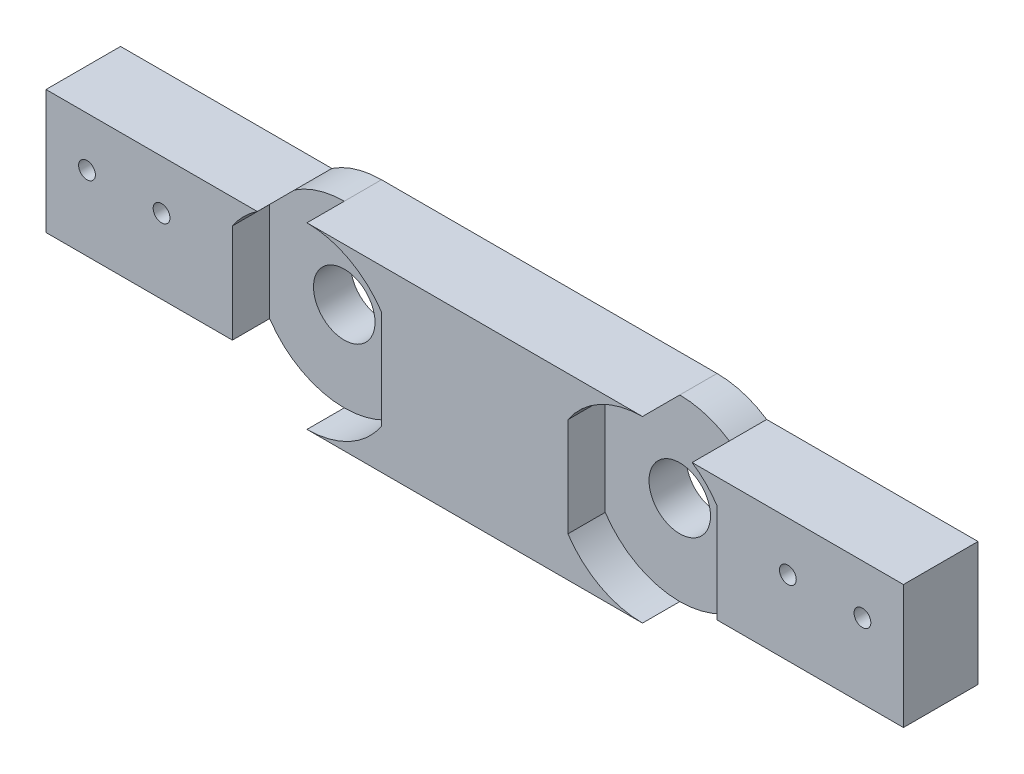
from build123d import *

# Parameters (mm, degrees)
SKETCH_1_W                  = 130
SKETCH_1_H                  = 48
SKETCH_1_R                  = 8.25
EXTRUDE_1_DEPTH             = 10
CUT_EXTRUDE_1_DEPTH         = 10
EXTRUDE_START               = 10
EXTRUDE_2_DEPTH             = 10
SKETCH_6_W                  = 10
SKETCH_6_H                  = 26.532998322
EXTRUDE_3_DEPTH             = 50
SKETCH_7_W                  = 50
SKETCH_7_H                  = 26.532998322
EXTRUDE_4_DEPTH             = 10
HOLE_WIZARD_M4_1_AT_2_COUNT = 2
HOLE_WIZARD_M4_1_AT_2_PITCH = 20
EXTRUDE_6_DEPTH             = 20


with BuildPart() as part:
    # 스케치1 → 보스-돌출1 (new body)
    with BuildSketch(Plane.XY):
        with Locations((45, 0)):
            Rectangle(SKETCH_1_W, SKETCH_1_H)
        Circle(SKETCH_1_R, mode=Mode.SUBTRACT)
        with Locations((90, 0)):
            Circle(SKETCH_1_R, mode=Mode.SUBTRACT)
    extrude(amount=EXTRUDE_1_DEPTH)

    # 스케치4 → 컷-돌출1 (cut)
    with BuildSketch(Plane.XY.offset(10)):
        with BuildLine():
            Line((-20, 24), (-20, 13.266499161))
            ThreePointArc((-20, 13.266499161), (-11.349097324, 21.147056295), (0, 24))
            Line((0, 24), (-20, 24))
        make_face()
        with BuildLine():
            ThreePointArc((0, -24), (-11.349097324, -21.147056295), (-20, -13.266499161))
            Line((-20, -13.266499161), (-20, -24))
            Line((-20, -24), (0, -24))
        make_face()
        with BuildLine():
            ThreePointArc((110, -13.266499161), (101.349097324, -21.147056295), (90, -24))
            Line((90, -24), (110, -24))
            Line((110, -24), (110, -13.266499161))
        make_face()
        with BuildLine():
            Line((110, 24), (90, 24))
            ThreePointArc((90, 24), (101.349097324, 21.147056295), (110, 13.266499161))
            Line((110, 13.266499161), (110, 24))
        make_face()
    extrude(amount=-CUT_EXTRUDE_1_DEPTH, mode=Mode.SUBTRACT)

    # 스케치5 → 보스-돌출2 (add)
    with BuildSketch(Plane.XY.offset(10).offset(EXTRUDE_START)):
        with BuildLine():
            Line((20, -13.266499161), (20, 13.266499161))
            ThreePointArc((20, 13.266499161), (11.349097324, 21.147056295), (0, 24))
            Line((0, 24), (90, 24))
            ThreePointArc((90, 24), (78.650902676, 21.147056295), (70, 13.266499161))
            Line((70, 13.266499161), (70, -13.266499161))
            ThreePointArc((70, -13.266499161), (78.650902676, -21.147056295), (90, -24))
            Line((90, -24), (0, -24))
            ThreePointArc((0, -24), (11.349097324, -21.147056295), (20, -13.266499161))
        make_face()
    extrude(amount=-EXTRUDE_2_DEPTH)

    # 스케치6 → 보스-돌출3 (add)
    with BuildSketch(Plane(origin=(110, 0, 0), x_dir=(0, 0, -1), z_dir=(1, 0, 0))):
        with Locations((-5, 0)):
            Rectangle(SKETCH_6_W, SKETCH_6_H)
    extrude_3 = extrude(amount=EXTRUDE_3_DEPTH)

    # 스케치7 → 보스-돌출4 (add)
    with BuildSketch(Plane.XY.offset(10)):
        with Locations((135, 0)):
            Rectangle(SKETCH_7_W, SKETCH_7_H)
    extrude_4 = extrude(amount=EXTRUDE_4_DEPTH)

    # 대칭 복사2: 보스-돌출3, 보스-돌출4 across plane
    add(extrude_3.mirror(Plane.ZY.offset(-45)))
    add(extrude_4.mirror(Plane.ZY.offset(-45)))

    # 스케치11 → M4 남비 머리 나사용 카운터보어1 (revolve, cut)
    with BuildSketch(Plane(origin=(-59, 6.733500839, 30), x_dir=(0, -1, 0), z_dir=(1, 0, 0))):
        Polygon((0, 0), (0, 31.351936393), (2.25, 30), (2.25, 3.1), (4.5, 3.1), (4.5, 0), align=None)
    hole_wizard_m4_1 = revolve(axis=Axis((-59, 6.733500839, 36.35), (0, 0, -1)), mode=Mode.SUBTRACT)

    # M4 남비 머리 나사용 카운터보어1 at 2: M4 남비 머리 나사용 카운터보어1 ×2
    with Locations(*[(i * HOLE_WIZARD_M4_1_AT_2_PITCH, 0, 0) for i in range(1, HOLE_WIZARD_M4_1_AT_2_COUNT)]):
        add(hole_wizard_m4_1, mode=Mode.SUBTRACT)

    # 스케치14 → 보스-돌출6 (add, through all)
    with BuildSketch(Plane.XY.offset(20)):
        with BuildLine():
            ThreePointArc((-20, 13.266499161), (-16.991935867, 16.949162679), (-13.316865669, 19.966499161))
            Line((-13.316865669, 19.966499161), (-70, 19.966499161))
            Line((-70, 19.966499161), (-70, 13.266499161))
            Line((-70, 13.266499161), (-20, 13.266499161))
        make_face()
    extrude_6 = extrude(amount=-EXTRUDE_6_DEPTH)

    # 대칭 복사3: M4 남비 머리 나사용 카운터보어1, 보스-돌출6 across plane
    add(hole_wizard_m4_1.mirror(Plane.ZY.offset(-45)), mode=Mode.SUBTRACT)
    add(extrude_6.mirror(Plane.ZY.offset(-45)))

    # 대칭 복사3 copy 1 sketch → 대칭 복사3 copy 1 (revolve, cut)
    with BuildSketch(Plane(origin=(129, 6.733500839, 30), x_dir=(0, -1, 0), z_dir=(-1, 0, 0))):
        Polygon((0, 0), (0, -31.351936393), (2.25, -30), (2.25, -3.1), (4.5, -3.1), (4.5, 0), align=None)
    revolve(axis=Axis((129, 6.733500839, 36.35), (0, 0, 1)), mode=Mode.SUBTRACT)


solid = part.part
